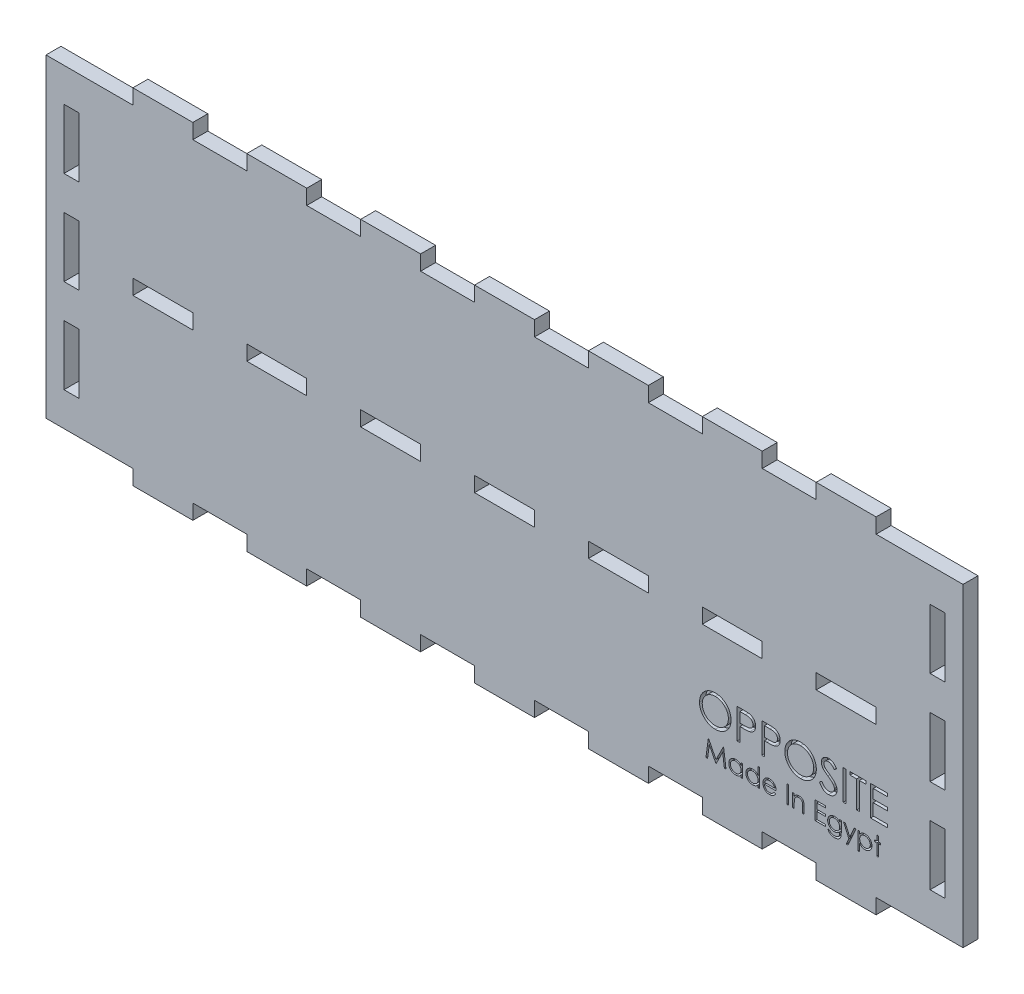
from build123d import *

# Parameters (mm, degrees)
SKETCH1_W           = 2.5
SKETCH1_H           = 10
SKETCH1_W_2         = 10
SKETCH1_H_2         = 2.5
BOSS_EXTRUDE1_DEPTH = 2.5
SKETCH2_W           = 0.448717949
SKETCH2_H           = 5
SKETCH2_W_2         = 0.26923077
SKETCH2_H_2         = 3
CUT_EXTRUDE1_DEPTH  = 1


with BuildPart() as part:
    # Sketch1 → Boss-Extrude1 (new body)
    with BuildSketch(Plane.XY):
        Polygon((-76.5, 26.25), (-62, 26.25), (-62, 28.75), (-52, 28.75), (-52, 26.25), (-43, 26.25), (-43, 28.75), (-33, 28.75), (-33, 26.25), (-24, 26.25), (-24, 28.75), (-14, 28.75), (-14, 26.25), (-5, 26.25), (-5, 28.75), (5, 28.75), (5, 26.25), (14, 26.25), (14, 28.75), (24, 28.75), (24, 26.25), (33, 26.25), (33, 28.75), (43, 28.75), (43, 26.25), (52, 26.25), (52, 28.75), (62, 28.75), (62, 26.25), (76.5, 26.25), (76.5, -26.25), (62, -26.25), (62, -28.75), (52, -28.75), (52, -26.25), (43, -26.25), (43, -28.75), (33, -28.75), (33, -26.25), (24, -26.25), (24, -28.75), (14, -28.75), (14, -26.25), (5, -26.25), (5, -28.75), (-5, -28.75), (-5, -26.25), (-14, -26.25), (-14, -28.75), (-24, -28.75), (-24, -26.25), (-33, -26.25), (-33, -28.75), (-43, -28.75), (-43, -26.25), (-52, -26.25), (-52, -28.75), (-62, -28.75), (-62, -26.25), (-76.5, -26.25), align=None)
        with Locations((-72.25, 15.625)):
            Rectangle(SKETCH1_W, SKETCH1_H, mode=Mode.SUBTRACT)
        with Locations((72.25, 15.625)):
            Rectangle(SKETCH1_W, SKETCH1_H, mode=Mode.SUBTRACT)
        with Locations((72.25, 0)):
            Rectangle(SKETCH1_W, SKETCH1_H, mode=Mode.SUBTRACT)
        with Locations((-72.25, 0)):
            Rectangle(SKETCH1_W, SKETCH1_H, mode=Mode.SUBTRACT)
        with Locations((72.25, -15.625)):
            Rectangle(SKETCH1_W, SKETCH1_H, mode=Mode.SUBTRACT)
        with Locations((-72.25, -15.625)):
            Rectangle(SKETCH1_W, SKETCH1_H, mode=Mode.SUBTRACT)
        with Locations((-38, 0)):
            Rectangle(SKETCH1_W_2, SKETCH1_H_2, mode=Mode.SUBTRACT)
        with Locations((-57, 0)):
            Rectangle(SKETCH1_W_2, SKETCH1_H_2, mode=Mode.SUBTRACT)
        with Locations((-19, 0)):
            Rectangle(SKETCH1_W_2, SKETCH1_H_2, mode=Mode.SUBTRACT)
        Rectangle(SKETCH1_W_2, SKETCH1_H_2, mode=Mode.SUBTRACT)
        with Locations((19, 0)):
            Rectangle(SKETCH1_W_2, SKETCH1_H_2, mode=Mode.SUBTRACT)
        with Locations((38, 0)):
            Rectangle(SKETCH1_W_2, SKETCH1_H_2, mode=Mode.SUBTRACT)
        with Locations((57, 0)):
            Rectangle(SKETCH1_W_2, SKETCH1_H_2, mode=Mode.SUBTRACT)
    extrude(amount=BOSS_EXTRUDE1_DEPTH)

    # Sketch2 → Cut-Extrude1 (cut)
    # profile 1 of 19: a face of its own
    with BuildSketch(Plane.XY.offset(2.5)):
        with BuildLine():
            add(Edge.make_bspline(
                [(35.135157571, -10.093090137), (35.227740579, -10.095435107), (35.409581247, -10.100040823), (35.6768311, -10.135296685), (35.931966951, -10.196290099), (36.177067149, -10.277522931), (36.409199973, -10.385886339), (36.630112676, -10.516865122), (36.839279639, -10.671831492), (37.033881613, -10.84958753), (37.21196297, -11.042992464), (37.368857093, -11.249389479), (37.500346084, -11.467530625), (37.60832578, -11.696760383), (37.69303808, -11.936560337), (37.751493857, -12.188208913), (37.788834071, -12.450075613), (37.793199467, -12.628685419), (37.795413981, -12.71929206)],
                knots=[0, 0, 0, 0, 1.065120563, 2.091984664, 3.0946048, 4.079830382, 5.057816894, 6.036188127, 7.030412546, 8.04752943, 9.064399622, 10.05169764, 11.02544977, 11.989514704, 12.962713494, 13.945757189, 14.957906945, 16, 16, 16, 16], degree=3))
            add(Edge.make_bspline(
                [(37.795413981, -12.71929206), (37.793199792, -12.809231269), (37.788835368, -12.986511869), (37.7514514, -13.24671679), (37.6928214, -13.496846356), (37.609112449, -13.736483003), (37.501647479, -13.965879522), (37.369282949, -14.184432314), (37.213366934, -14.392213026), (37.035928575, -14.586945405), (36.842498515, -14.76551322), (36.635026706, -14.921111614), (36.418179106, -15.05500322), (36.189165237, -15.16183704), (35.951022327, -15.247225498), (35.701619008, -15.305443541), (35.442123931, -15.34299646), (35.265165354, -15.347308625), (35.175221674, -15.349500393)],
                knots=[0, 0, 0, 0, 1.043624062, 2.057103931, 3.04512605, 4.022047818, 4.998200453, 5.980619268, 6.982898556, 8.009068085, 9.034988726, 10.034168286, 11.015286542, 11.987931943, 12.962482838, 13.94673481, 14.956375938, 16, 16, 16, 16], degree=3))
            add(Edge.make_bspline(
                [(35.175221674, -15.349500393), (35.084615504, -15.347286983), (34.906006624, -15.342923763), (34.643810859, -15.305521756), (34.391985511, -15.24703418), (34.151250723, -15.163449271), (33.921472252, -15.055424655), (33.702200705, -14.923704114), (33.494316209, -14.767408198), (33.299542286, -14.590027377), (33.121329146, -14.39692516), (32.965958609, -14.190019081), (32.834208447, -13.973368429), (32.726546543, -13.746371966), (32.641311602, -13.510127048), (32.583161861, -13.263057794), (32.545539073, -13.006572786), (32.541203578, -12.831940074), (32.539003725, -12.743330521)],
                knots=[0, 0, 0, 0, 1.053102029, 2.075944431, 3.073151272, 4.055350789, 5.033113405, 6.020478099, 7.024410459, 8.052272461, 9.079885166, 10.07527673, 11.055994387, 12.023226415, 12.992069828, 13.970394897, 14.97016774, 16, 16, 16, 16], degree=3))
            add(Edge.make_bspline(
                [(32.539003725, -12.743330521), (32.53976749, -12.68385528), (32.541285385, -12.565655103), (32.559559231, -12.390131389), (32.586075947, -12.217430449), (32.624078679, -12.04804338), (32.673781061, -11.882384831), (32.732426814, -11.719312312), (32.804055165, -11.560478421), (32.885027519, -11.405130719), (32.97540153, -11.255690853), (33.07522403, -11.114434306), (33.180988842, -10.980175739), (33.296936547, -10.856394305), (33.419245754, -10.739489082), (33.54990058, -10.631256629), (33.688103786, -10.530720985), (33.834450043, -10.440120497), (33.985333293, -10.358178877), (34.140871547, -10.287861947), (34.298952363, -10.22751043), (34.460316146, -10.178594966), (34.624534392, -10.139977771), (34.791965513, -10.113681552), (34.962476122, -10.095361098), (35.077349435, -10.09385038), (35.135157571, -10.093090137)],
                knots=[0, 0, 0, 0, 1.037015668, 2.060948919, 3.074880161, 4.083647147, 5.086022904, 6.090072063, 7.104153813, 8.122640571, 9.144368836, 10.147691507, 11.138137339, 12.123020368, 13.103399296, 14.087645067, 15.080126199, 16.082011238, 17.087798457, 18.072939717, 19.057185487, 20.037253025, 21.01195951, 21.997135196, 22.992090687, 24, 24, 24, 24], degree=3))
        make_face()
        with BuildLine():
            add(Edge.make_bspline(
                [(35.157192827, -10.605910649), (35.109743351, -10.606489064), (35.015298018, -10.607640364), (34.874891538, -10.622805672), (34.736331632, -10.644419799), (34.599589686, -10.675250543), (34.465237844, -10.717256332), (34.332023786, -10.765600487), (34.20116228, -10.824487759), (34.07308534, -10.891020194), (33.948920947, -10.964661509), (33.831759945, -11.046049748), (33.721299025, -11.133276254), (33.617808644, -11.226544593), (33.521592684, -11.326329739), (33.430757396, -11.431118933), (33.348943708, -11.543907349), (33.273964313, -11.661636501), (33.206867398, -11.784153046), (33.147202606, -11.910167135), (33.098396879, -12.040706688), (33.058593484, -12.174355484), (33.025593754, -12.310901855), (33.004688148, -12.451381639), (32.989356206, -12.595088942), (32.988270713, -12.692205876), (32.987721674, -12.741327316)],
                knots=[0, 0, 0, 0, 1.008559885, 2.007477868, 2.99961109, 3.989939068, 4.984837346, 5.991145699, 7.001802488, 8.033829008, 9.059044045, 10.069351652, 11.065060232, 12.050310815, 13.029377138, 14.011219647, 14.996725999, 15.989392538, 16.977580475, 17.965360261, 18.951710183, 19.937753436, 20.929683414, 21.935841486, 22.955955122, 24, 24, 24, 24], degree=3))
            add(Edge.make_bspline(
                [(32.987721674, -12.741327316), (32.989542905, -12.81355906), (32.99312583, -12.955661246), (33.024493788, -13.163901452), (33.072810894, -13.364027575), (33.144035703, -13.554944588), (33.23310801, -13.738293564), (33.343146425, -13.912447999), (33.473516547, -14.077454962), (33.621607299, -14.232162489), (33.78349688, -14.373370781), (33.95540078, -14.497318508), (34.135477362, -14.602190293), (34.324196223, -14.687626111), (34.52054985, -14.755325736), (34.725803495, -14.801723781), (34.938589865, -14.832260146), (35.083633659, -14.835192654), (35.157192827, -14.83667988)],
                knots=[0, 0, 0, 0, 1.032063989, 2.030389145, 3.003944642, 3.970395727, 4.937377036, 5.913328081, 6.909231446, 7.93887556, 8.970685674, 9.976071282, 10.964166581, 11.944589148, 12.933237628, 13.927779006, 14.949070134, 16, 16, 16, 16], degree=3))
            add(Edge.make_bspline(
                [(35.157192827, -14.83667988), (35.206634973, -14.836000588), (35.304693596, -14.834653348), (35.450544342, -14.82108381), (35.593767502, -14.799323996), (35.734162187, -14.767994488), (35.871569061, -14.728784194), (36.006561637, -14.682201725), (36.137702051, -14.62408572), (36.266644677, -14.55987436), (36.390067879, -14.486674135), (36.507890068, -14.408048207), (36.617141468, -14.320950178), (36.720554427, -14.229067588), (36.817165411, -14.130547806), (36.906321103, -14.025518917), (36.987721292, -13.913317978), (37.062672216, -13.795767399), (37.12953402, -13.672915609), (37.187789875, -13.546444641), (37.237212898, -13.416665913), (37.277110762, -13.283392239), (37.308375707, -13.146876741), (37.32991845, -13.00693663), (37.344987648, -12.863851855), (37.346123473, -12.767074917), (37.346696033, -12.718290457)],
                knots=[0, 0, 0, 0, 1.047197238, 2.076906641, 3.100256066, 4.114471768, 5.12198147, 6.126382909, 7.136867548, 8.15857795, 9.17633901, 10.174870724, 11.156907918, 12.133735059, 13.104061851, 14.077631395, 15.04955518, 16.038496417, 17.029181396, 18.010275684, 18.986308667, 19.968651475, 20.955262928, 21.950658345, 22.966943676, 24, 24, 24, 24], degree=3))
            add(Edge.make_bspline(
                [(37.346696033, -12.718290457), (37.346123014, -12.669839737), (37.344986326, -12.573728808), (37.329925648, -12.431641924), (37.308352948, -12.292708765), (37.277263365, -12.157474761), (37.237191717, -12.025905439), (37.187781245, -11.898124371), (37.129516531, -11.773655521), (37.062647639, -11.652806525), (36.987482177, -11.536842614), (36.905347544, -11.425982025), (36.814825618, -11.32230668), (36.718502725, -11.223257117), (36.613972889, -11.130945846), (36.501709612, -11.045342245), (36.383075786, -10.964380425), (36.25746545, -10.891343908), (36.12783123, -10.823895004), (35.99481129, -10.766107857), (35.859912577, -10.717004829), (35.72347813, -10.67512345), (35.58435959, -10.64454055), (35.443496977, -10.622786193), (35.301085179, -10.607645642), (35.205309151, -10.606490815), (35.157192827, -10.605910649)],
                knots=[0, 0, 0, 0, 1.02996197, 2.043119294, 3.035359645, 4.018872909, 4.991431989, 5.957985074, 6.929999688, 7.912076566, 8.892894881, 9.867085534, 10.843653904, 11.817741046, 12.803660682, 13.806313499, 14.818574707, 15.856120519, 16.894564902, 17.924820532, 18.937903209, 19.946497019, 20.957711757, 21.963978472, 22.977135795, 24, 24, 24, 24], degree=3))
        make_face(mode=Mode.SUBTRACT)
    # profile 2 of 19: a face of its own
    with BuildSketch(Plane.XY.offset(2.5)):
        with BuildLine():
            Line((38.821055007, -10.221295265), (39.801623917, -10.221295265))
            add(Edge.make_bspline(
                [(39.801623917, -10.221295265), (39.869068069, -10.221369402), (39.998294059, -10.221511453), (40.183601281, -10.225818233), (40.351900898, -10.23157065), (40.502830013, -10.239544783), (40.63685301, -10.248968483), (40.753363438, -10.262185683), (40.85327709, -10.275986105), (40.913143447, -10.290016686), (40.940446033, -10.296415457)],
                knots=[0, 0, 0, 0, 1.415646017, 2.712440637, 3.8905458, 4.950247383, 5.884950622, 6.709939814, 7.411656543, 8, 8, 8, 8], degree=3))
            add(Edge.make_bspline(
                [(40.940446033, -10.296415457), (40.975008224, -10.305875385), (41.043318191, -10.324572331), (41.141748253, -10.362020507), (41.235396603, -10.4064236), (41.324584544, -10.457029229), (41.408216091, -10.516008606), (41.487539007, -10.580970917), (41.561853264, -10.653416015), (41.630740967, -10.732531358), (41.694004964, -10.8169888), (41.748475939, -10.908049129), (41.794086263, -11.004179562), (41.833205223, -11.105313235), (41.861360158, -11.212299412), (41.882570014, -11.324394715), (41.896032339, -11.44158713), (41.897321713, -11.521672655), (41.897978084, -11.562441098)],
                knots=[0, 0, 0, 0, 0.999701418, 1.975846123, 2.934577507, 3.890451536, 4.834027766, 5.787354733, 6.749476667, 7.726910423, 8.712836071, 9.690891519, 10.682875813, 11.679750201, 12.712814741, 13.765529915, 14.8625177, 16, 16, 16, 16], degree=3))
            add(Edge.make_bspline(
                [(41.897978084, -11.562441098), (41.897376048, -11.603552208), (41.896198126, -11.683988871), (41.882060575, -11.801664282), (41.863017444, -11.914119125), (41.833735941, -12.021104055), (41.795384979, -12.121983727), (41.750396333, -12.218299772), (41.696134146, -12.308413589), (41.63378439, -12.392652329), (41.564424969, -12.471095061), (41.488349343, -12.543173338), (41.40586464, -12.60846525), (41.317232999, -12.66711717), (41.221590358, -12.717768998), (41.120387282, -12.763136576), (41.012744115, -12.801238092), (40.93825481, -12.821281036), (40.90038193, -12.831471547)],
                knots=[0, 0, 0, 0, 1.121902311, 2.195077645, 3.232258892, 4.234102512, 5.217864754, 6.176164875, 7.132989551, 8.084763148, 9.034132444, 9.988522005, 10.94243251, 11.903244335, 12.886203696, 13.894208494, 14.929344452, 16, 16, 16, 16], degree=3))
            add(Edge.make_bspline(
                [(40.90038193, -12.831471547), (40.869057167, -12.838132948), (40.800407128, -12.852731797), (40.687346096, -12.869029593), (40.555709831, -12.882940451), (40.405678002, -12.893370647), (40.237385281, -12.902299745), (40.050740628, -12.909397022), (39.84537766, -12.913296813), (39.702133026, -12.913497946), (39.627345071, -12.913602957)],
                knots=[0, 0, 0, 0, 0.601384939, 1.31797006, 2.144135048, 3.087295005, 4.142315834, 5.309527816, 6.595305764, 8, 8, 8, 8], degree=3))
            Line((39.627345071, -12.913602957), (39.269772956, -12.913602957))
            Line((39.269772956, -12.913602957), (39.269772956, -15.221295265))
            Line((39.269772956, -15.221295265), (38.821055007, -15.221295265))
            Line((38.821055007, -15.221295265), (38.821055007, -10.221295265))
        make_face()
        with BuildLine():
            Line((39.269772956, -10.734115778), (39.269772956, -12.400782444))
            Line((39.269772956, -12.400782444), (40.145173597, -12.411800072))
            add(Edge.make_bspline(
                [(40.145173597, -12.411800072), (40.187916348, -12.411822163), (40.270430348, -12.411864809), (40.389624952, -12.406171633), (40.500209648, -12.399599443), (40.601844756, -12.389976695), (40.694576091, -12.376374899), (40.778558275, -12.362643845), (40.853140108, -12.342779041), (40.940424682, -12.3160318), (41.037686607, -12.270413777), (41.14349739, -12.204199649), (41.233169657, -12.119798637), (41.310767223, -12.024901735), (41.372347049, -11.91933155), (41.417427038, -11.806375926), (41.443914406, -11.687193284), (41.447466111, -11.6056388), (41.449260135, -11.564444303)],
                knots=[0, 0, 0, 0, 1.160613943, 2.240541288, 3.23993089, 4.169200891, 5.011653406, 5.7853311, 6.478053781, 7.106038997, 8.262395093, 9.384106736, 10.481365981, 11.59014053, 12.70357646, 13.786202915, 14.881775077, 16, 16, 16, 16], degree=3))
            add(Edge.make_bspline(
                [(41.449260135, -11.564444303), (41.447456354, -11.524246427), (41.443870662, -11.444338024), (41.417219429, -11.327225509), (41.372434694, -11.215460217), (41.310353845, -11.111212952), (41.235009374, -11.016657518), (41.147438884, -10.934518765), (41.04784851, -10.868487761), (40.95520818, -10.825868787), (40.872920772, -10.799846965), (40.801446543, -10.78164005), (40.72074558, -10.76710347), (40.630791609, -10.755332751), (40.532281846, -10.745256378), (40.424369968, -10.738419268), (40.307464763, -10.734417187), (40.226306805, -10.73421868), (40.184236097, -10.734115778)],
                knots=[0, 0, 0, 0, 1.120700087, 2.227813068, 3.331159281, 4.466773991, 5.599788987, 6.693661531, 7.80175334, 8.91857717, 9.525282508, 10.207424825, 10.974604443, 11.810962634, 12.737642355, 13.736264703, 14.826523623, 16, 16, 16, 16], degree=3))
            Line((40.184236097, -10.734115778), (39.269772956, -10.734115778))
        make_face(mode=Mode.SUBTRACT)
    # profile 3 of 19: a face of its own
    with BuildSketch(Plane.XY.offset(2.5)):
        with BuildLine():
            Line((42.923619109, -10.221295265), (43.90418802, -10.221295265))
            add(Edge.make_bspline(
                [(43.90418802, -10.221295265), (43.971632171, -10.221369402), (44.100858161, -10.221511453), (44.286165384, -10.225818233), (44.454465, -10.23157065), (44.605394116, -10.239544783), (44.739417113, -10.248968483), (44.855927541, -10.262185683), (44.955841193, -10.275986105), (45.015707549, -10.290016686), (45.043010135, -10.296415457)],
                knots=[0, 0, 0, 0, 1.415646017, 2.712440637, 3.8905458, 4.950247383, 5.884950622, 6.709939814, 7.411656543, 8, 8, 8, 8], degree=3))
            add(Edge.make_bspline(
                [(45.043010135, -10.296415457), (45.077572326, -10.305875385), (45.145882294, -10.324572331), (45.244312355, -10.362020507), (45.337960706, -10.4064236), (45.427148647, -10.457029229), (45.510780194, -10.516008606), (45.590103109, -10.580970917), (45.664417367, -10.653416015), (45.73330507, -10.732531358), (45.796569066, -10.8169888), (45.851040042, -10.908049129), (45.896650366, -11.004179562), (45.935769325, -11.105313235), (45.96392426, -11.212299412), (45.985134117, -11.324394715), (45.998596442, -11.44158713), (45.999885816, -11.521672655), (46.000542186, -11.562441098)],
                knots=[0, 0, 0, 0, 0.999701418, 1.975846123, 2.934577507, 3.890451536, 4.834027766, 5.787354733, 6.749476667, 7.726910423, 8.712836071, 9.690891519, 10.682875813, 11.679750201, 12.712814741, 13.765529915, 14.8625177, 16, 16, 16, 16], degree=3))
            add(Edge.make_bspline(
                [(46.000542186, -11.562441098), (45.999940151, -11.603552208), (45.998762228, -11.683988871), (45.984624678, -11.801664282), (45.965581547, -11.914119125), (45.936300044, -12.021104055), (45.897949082, -12.121983727), (45.852960435, -12.218299772), (45.798698249, -12.308413589), (45.736348492, -12.392652329), (45.666989072, -12.471095061), (45.590913446, -12.543173338), (45.508428742, -12.60846525), (45.419797102, -12.66711717), (45.324154461, -12.717768998), (45.222951384, -12.763136576), (45.115308218, -12.801238092), (45.040818912, -12.821281036), (45.002946033, -12.831471547)],
                knots=[0, 0, 0, 0, 1.121902311, 2.195077645, 3.232258892, 4.234102512, 5.217864754, 6.176164875, 7.132989551, 8.084763148, 9.034132444, 9.988522005, 10.94243251, 11.903244335, 12.886203696, 13.894208494, 14.929344452, 16, 16, 16, 16], degree=3))
            add(Edge.make_bspline(
                [(45.002946033, -12.831471547), (44.97162127, -12.838132948), (44.902971231, -12.852731797), (44.789910199, -12.869029593), (44.658273933, -12.882940451), (44.508242105, -12.893370647), (44.339949384, -12.902299745), (44.15330473, -12.909397022), (43.947941763, -12.913296813), (43.804697128, -12.913497946), (43.729909174, -12.913602957)],
                knots=[0, 0, 0, 0, 0.601384939, 1.31797006, 2.144135048, 3.087295005, 4.142315834, 5.309527816, 6.595305764, 8, 8, 8, 8], degree=3))
            Line((43.729909174, -12.913602957), (43.372337058, -12.913602957))
            Line((43.372337058, -12.913602957), (43.372337058, -15.221295265))
            Line((43.372337058, -15.221295265), (42.923619109, -15.221295265))
            Line((42.923619109, -15.221295265), (42.923619109, -10.221295265))
        make_face()
        with BuildLine():
            Line((43.372337058, -10.734115778), (43.372337058, -12.400782444))
            Line((43.372337058, -12.400782444), (44.247737699, -12.411800072))
            add(Edge.make_bspline(
                [(44.247737699, -12.411800072), (44.29048045, -12.411822163), (44.37299445, -12.411864809), (44.492189055, -12.406171633), (44.602773751, -12.399599443), (44.704408859, -12.389976695), (44.797140194, -12.376374899), (44.881122378, -12.362643845), (44.955704211, -12.342779041), (45.042988784, -12.3160318), (45.140250709, -12.270413777), (45.246061493, -12.204199649), (45.335733759, -12.119798637), (45.413331326, -12.024901735), (45.474911152, -11.91933155), (45.519991141, -11.806375926), (45.546478508, -11.687193284), (45.550030214, -11.6056388), (45.551824238, -11.564444303)],
                knots=[0, 0, 0, 0, 1.160613943, 2.240541288, 3.23993089, 4.169200891, 5.011653406, 5.7853311, 6.478053781, 7.106038997, 8.262395093, 9.384106736, 10.481365981, 11.59014053, 12.70357646, 13.786202915, 14.881775077, 16, 16, 16, 16], degree=3))
            add(Edge.make_bspline(
                [(45.551824238, -11.564444303), (45.550020457, -11.524246427), (45.546434764, -11.444338024), (45.519783531, -11.327225509), (45.474998797, -11.215460217), (45.412917948, -11.111212952), (45.337573476, -11.016657518), (45.250002986, -10.934518765), (45.150412613, -10.868487761), (45.057772283, -10.825868787), (44.975484874, -10.799846965), (44.904010646, -10.78164005), (44.823309682, -10.76710347), (44.733355711, -10.755332751), (44.634845949, -10.745256378), (44.52693407, -10.738419268), (44.410028866, -10.734417187), (44.328870907, -10.73421868), (44.286800199, -10.734115778)],
                knots=[0, 0, 0, 0, 1.120700087, 2.227813068, 3.331159281, 4.466773991, 5.599788987, 6.693661531, 7.80175334, 8.91857717, 9.525282508, 10.207424825, 10.974604443, 11.810962634, 12.737642355, 13.736264703, 14.826523623, 16, 16, 16, 16], degree=3))
            Line((44.286800199, -10.734115778), (43.372337058, -10.734115778))
        make_face(mode=Mode.SUBTRACT)
    # profile 4 of 19: a face of its own
    with BuildSketch(Plane.XY.offset(2.5)):
        with BuildLine():
            add(Edge.make_bspline(
                [(49.365926802, -10.093090137), (49.45850981, -10.095435107), (49.640350477, -10.100040823), (49.907600331, -10.135296685), (50.162736182, -10.196290099), (50.40783638, -10.277522931), (50.639969204, -10.385886339), (50.860881907, -10.516865122), (51.07004887, -10.671831492), (51.264650843, -10.84958753), (51.442732201, -11.042992464), (51.599626324, -11.249389479), (51.731115315, -11.467530625), (51.839095011, -11.696760383), (51.923807311, -11.936560337), (51.982263087, -12.188208913), (52.019603302, -12.450075613), (52.023968698, -12.628685419), (52.026183212, -12.71929206)],
                knots=[0, 0, 0, 0, 1.065120563, 2.091984664, 3.0946048, 4.079830382, 5.057816894, 6.036188127, 7.030412546, 8.04752943, 9.064399622, 10.05169764, 11.02544977, 11.989514704, 12.962713494, 13.945757189, 14.957906945, 16, 16, 16, 16], degree=3))
            add(Edge.make_bspline(
                [(52.026183212, -12.71929206), (52.023969023, -12.809231269), (52.019604599, -12.986511869), (51.982220631, -13.24671679), (51.923590631, -13.496846356), (51.839881679, -13.736483003), (51.73241671, -13.965879522), (51.60005218, -14.184432314), (51.444136165, -14.392213026), (51.266697806, -14.586945405), (51.073267746, -14.76551322), (50.865795936, -14.921111614), (50.648948336, -15.05500322), (50.419934468, -15.16183704), (50.181791558, -15.247225498), (49.932388239, -15.305443541), (49.672893162, -15.34299646), (49.495934585, -15.347308625), (49.405990904, -15.349500393)],
                knots=[0, 0, 0, 0, 1.043624062, 2.057103931, 3.04512605, 4.022047818, 4.998200453, 5.980619268, 6.982898556, 8.009068085, 9.034988726, 10.034168286, 11.015286542, 11.987931943, 12.962482838, 13.94673481, 14.956375938, 16, 16, 16, 16], degree=3))
            add(Edge.make_bspline(
                [(49.405990904, -15.349500393), (49.315384734, -15.347286983), (49.136775854, -15.342923763), (48.87458009, -15.305521756), (48.622754741, -15.24703418), (48.382019954, -15.163449271), (48.152241483, -15.055424655), (47.932969936, -14.923704114), (47.72508544, -14.767408198), (47.530311517, -14.590027377), (47.352098376, -14.39692516), (47.19672784, -14.190019081), (47.064977678, -13.973368429), (46.957315774, -13.746371966), (46.872080832, -13.510127048), (46.813931092, -13.263057794), (46.776308303, -13.006572786), (46.771972808, -12.831940074), (46.769772956, -12.743330521)],
                knots=[0, 0, 0, 0, 1.053102029, 2.075944431, 3.073151272, 4.055350789, 5.033113405, 6.020478099, 7.024410459, 8.052272461, 9.079885166, 10.07527673, 11.055994387, 12.023226415, 12.992069828, 13.970394897, 14.97016774, 16, 16, 16, 16], degree=3))
            add(Edge.make_bspline(
                [(46.769772956, -12.743330521), (46.770536721, -12.68385528), (46.772054615, -12.565655103), (46.790328462, -12.390131389), (46.816845178, -12.217430449), (46.85484791, -12.04804338), (46.904550291, -11.882384831), (46.963196045, -11.719312312), (47.034824395, -11.560478421), (47.11579675, -11.405130719), (47.206170761, -11.255690853), (47.30599326, -11.114434306), (47.411758072, -10.980175739), (47.527705778, -10.856394305), (47.650014985, -10.739489082), (47.780669811, -10.631256629), (47.918873017, -10.530720985), (48.065219274, -10.440120497), (48.216102524, -10.358178877), (48.371640778, -10.287861947), (48.529721594, -10.22751043), (48.691085377, -10.178594966), (48.855303623, -10.139977771), (49.022734744, -10.113681552), (49.193245353, -10.095361098), (49.308118665, -10.09385038), (49.365926802, -10.093090137)],
                knots=[0, 0, 0, 0, 1.037015668, 2.060948919, 3.074880161, 4.083647147, 5.086022904, 6.090072063, 7.104153813, 8.122640571, 9.144368836, 10.147691507, 11.138137339, 12.123020368, 13.103399296, 14.087645067, 15.080126199, 16.082011238, 17.087798457, 18.072939717, 19.057185487, 20.037253025, 21.01195951, 21.997135196, 22.992090687, 24, 24, 24, 24], degree=3))
        make_face()
        with BuildLine():
            add(Edge.make_bspline(
                [(49.387962058, -10.605910649), (49.340512582, -10.606489064), (49.246067249, -10.607640364), (49.105660769, -10.622805672), (48.967100863, -10.644419799), (48.830358917, -10.675250543), (48.696007075, -10.717256332), (48.562793016, -10.765600487), (48.431931511, -10.824487759), (48.303854571, -10.891020194), (48.179690178, -10.964661509), (48.062529176, -11.046049748), (47.952068256, -11.133276254), (47.848577875, -11.226544593), (47.752361915, -11.326329739), (47.661526627, -11.431118933), (47.579712939, -11.543907349), (47.504733543, -11.661636501), (47.437636629, -11.784153046), (47.377971836, -11.910167135), (47.329166109, -12.040706688), (47.289362715, -12.174355484), (47.256362985, -12.310901855), (47.235457379, -12.451381639), (47.220125437, -12.595088942), (47.219039944, -12.692205876), (47.218490904, -12.741327316)],
                knots=[0, 0, 0, 0, 1.008559885, 2.007477868, 2.99961109, 3.989939068, 4.984837346, 5.991145699, 7.001802488, 8.033829008, 9.059044045, 10.069351652, 11.065060232, 12.050310815, 13.029377138, 14.011219647, 14.996725999, 15.989392538, 16.977580475, 17.965360261, 18.951710183, 19.937753436, 20.929683414, 21.935841486, 22.955955122, 24, 24, 24, 24], degree=3))
            add(Edge.make_bspline(
                [(47.218490904, -12.741327316), (47.220312136, -12.81355906), (47.223895061, -12.955661246), (47.255263019, -13.163901452), (47.303580125, -13.364027575), (47.374804934, -13.554944588), (47.463877241, -13.738293564), (47.573915655, -13.912447999), (47.704285778, -14.077454962), (47.85237653, -14.232162489), (48.014266111, -14.373370781), (48.186170011, -14.497318508), (48.366246593, -14.602190293), (48.554965454, -14.687626111), (48.751319081, -14.755325736), (48.956572725, -14.801723781), (49.169359096, -14.832260146), (49.314402889, -14.835192654), (49.387962058, -14.83667988)],
                knots=[0, 0, 0, 0, 1.032063989, 2.030389145, 3.003944642, 3.970395727, 4.937377036, 5.913328081, 6.909231446, 7.93887556, 8.970685674, 9.976071282, 10.964166581, 11.944589148, 12.933237628, 13.927779006, 14.949070134, 16, 16, 16, 16], degree=3))
            add(Edge.make_bspline(
                [(49.387962058, -14.83667988), (49.437404203, -14.836000588), (49.535462827, -14.834653348), (49.681313573, -14.82108381), (49.824536733, -14.799323996), (49.964931418, -14.767994488), (50.102338292, -14.728784194), (50.237330867, -14.682201725), (50.368471282, -14.62408572), (50.497413908, -14.55987436), (50.62083711, -14.486674135), (50.738659299, -14.408048207), (50.847910699, -14.320950178), (50.951323658, -14.229067588), (51.047934642, -14.130547806), (51.137090334, -14.025518917), (51.218490523, -13.913317978), (51.293441446, -13.795767399), (51.36030325, -13.672915609), (51.418559106, -13.546444641), (51.467982129, -13.416665913), (51.507879993, -13.283392239), (51.539144938, -13.146876741), (51.560687681, -13.00693663), (51.575756879, -12.863851855), (51.576892703, -12.767074917), (51.577465263, -12.718290457)],
                knots=[0, 0, 0, 0, 1.047197238, 2.076906641, 3.100256066, 4.114471768, 5.12198147, 6.126382909, 7.136867548, 8.15857795, 9.17633901, 10.174870724, 11.156907918, 12.133735059, 13.104061851, 14.077631395, 15.04955518, 16.038496417, 17.029181396, 18.010275684, 18.986308667, 19.968651475, 20.955262928, 21.950658345, 22.966943676, 24, 24, 24, 24], degree=3))
            add(Edge.make_bspline(
                [(51.577465263, -12.718290457), (51.576892245, -12.669839737), (51.575755557, -12.573728808), (51.560694879, -12.431641924), (51.539122178, -12.292708765), (51.508032595, -12.157474761), (51.467960947, -12.025905439), (51.418550475, -11.898124371), (51.360285762, -11.773655521), (51.29341687, -11.652806525), (51.218251408, -11.536842614), (51.136116774, -11.425982025), (51.045594848, -11.32230668), (50.949271956, -11.223257117), (50.84474212, -11.130945846), (50.732478842, -11.045342245), (50.613845017, -10.964380425), (50.488234681, -10.891343908), (50.358600461, -10.823895004), (50.225580521, -10.766107857), (50.090681807, -10.717004829), (49.954247361, -10.67512345), (49.815128821, -10.64454055), (49.674266208, -10.622786193), (49.53185441, -10.607645642), (49.436078382, -10.606490815), (49.387962058, -10.605910649)],
                knots=[0, 0, 0, 0, 1.02996197, 2.043119294, 3.035359645, 4.018872909, 4.991431989, 5.957985074, 6.929999688, 7.912076566, 8.892894881, 9.867085534, 10.843653904, 11.817741046, 12.803660682, 13.806313499, 14.818574707, 15.856120519, 16.894564902, 17.924820532, 18.937903209, 19.946497019, 20.957711757, 21.963978472, 22.977135795, 24, 24, 24, 24], degree=3))
        make_face(mode=Mode.SUBTRACT)
    # profile 5 of 19: a face of its own
    with BuildSketch(Plane.XY.offset(2.5)):
        with BuildLine():
            Line((52.539003725, -14.256751996), (52.961680007, -14.003346547))
            add(Edge.make_bspline(
                [(52.961680007, -14.003346547), (53.000991774, -14.069152811), (53.076311604, -14.195235074), (53.201956403, -14.365603703), (53.332146276, -14.510406784), (53.467845324, -14.628801938), (53.60822525, -14.722014633), (53.754202469, -14.788017821), (53.905285056, -14.8291835), (54.008104801, -14.834183624), (54.059436417, -14.83667988)],
                knots=[0, 0, 0, 0, 1.272034388, 2.437168799, 3.508375237, 4.49857839, 5.41946034, 6.295179144, 7.148887113, 8, 8, 8, 8], degree=3))
            add(Edge.make_bspline(
                [(54.059436417, -14.83667988), (54.103274789, -14.835458919), (54.190184465, -14.833038362), (54.318130526, -14.809780073), (54.442390244, -14.77404846), (54.560402584, -14.722875701), (54.670539176, -14.660963579), (54.767120169, -14.586183325), (54.850614617, -14.502460174), (54.918913352, -14.409056382), (54.971313402, -14.308603312), (55.011587785, -14.20549481), (55.033937891, -14.098111141), (55.037304681, -14.02581048), (55.039003725, -13.989324111)],
                knots=[0, 0, 0, 0, 1.095163259, 2.171163733, 3.241058638, 4.321873601, 5.38011039, 6.391990106, 7.366004449, 8.327778327, 9.272591725, 10.192022065, 11.087607919, 12, 12, 12, 12], degree=3))
            add(Edge.make_bspline(
                [(55.039003725, -13.989324111), (55.036897567, -13.947694326), (55.032616055, -13.863067055), (54.996428226, -13.738210408), (54.939500731, -13.614649594), (54.886982668, -13.538219215), (54.859716866, -13.498538854)],
                knots=[0, 0, 0, 0, 0.938893495, 1.908633276, 2.914225137, 4, 4, 4, 4], degree=3))
            add(Edge.make_bspline(
                [(54.859716866, -13.498538854), (54.837330274, -13.469900535), (54.790332425, -13.409777966), (54.709535979, -13.320284772), (54.614727244, -13.227972745), (54.509150737, -13.129316949), (54.38896061, -13.028905811), (54.257921304, -12.921951129), (54.112687219, -12.812520304), (54.010830796, -12.739130925), (53.958274558, -12.701263213)],
                knots=[0, 0, 0, 0, 0.722233717, 1.516239348, 2.393582979, 3.351407094, 4.387010283, 5.505090956, 6.712668013, 8, 8, 8, 8], degree=3))
            add(Edge.make_bspline(
                [(53.958274558, -12.701263213), (53.905668849, -12.663793803), (53.80509074, -12.592155142), (53.664435622, -12.485834736), (53.538657818, -12.388629209), (53.428316366, -12.299623477), (53.333459799, -12.21880547), (53.25334064, -12.146951271), (53.189999844, -12.082117613), (53.154777586, -12.040058553), (53.138963661, -12.021175072)],
                knots=[0, 0, 0, 0, 1.452282411, 2.77665338, 3.964542531, 5.026858415, 5.96415736, 6.766646006, 7.446254459, 8, 8, 8, 8], degree=3))
            add(Edge.make_bspline(
                [(53.138963661, -12.021175072), (53.116860025, -11.99174502), (53.073390258, -11.933866872), (53.01601025, -11.843402789), (52.967240018, -11.750798124), (52.929008115, -11.655804032), (52.896813516, -11.559754134), (52.875159329, -11.461395211), (52.861600191, -11.361168613), (52.860211639, -11.293720755), (52.859516545, -11.259957124)],
                knots=[0, 0, 0, 0, 1.068054152, 2.10047183, 3.106115577, 4.101338837, 5.06977816, 6.043150881, 7.020423561, 8, 8, 8, 8], degree=3))
            add(Edge.make_bspline(
                [(52.859516545, -11.259957124), (52.86138113, -11.207057446), (52.865070444, -11.102388783), (52.896271183, -10.949487597), (52.945518174, -10.803507001), (53.014510871, -10.665892238), (53.103449946, -10.540226551), (53.206372767, -10.425064427), (53.328960604, -10.328252167), (53.463464352, -10.243663512), (53.610687741, -10.177455047), (53.76496046, -10.12751079), (53.926527706, -10.099211851), (54.035960755, -10.095150758), (54.091487699, -10.093090137)],
                knots=[0, 0, 0, 0, 1.005424448, 1.989358655, 2.955360095, 3.929531133, 4.905563448, 5.876582895, 6.856512386, 7.866279853, 8.892233794, 9.918561126, 10.94386622, 12, 12, 12, 12], degree=3))
            add(Edge.make_bspline(
                [(54.091487699, -10.093090137), (54.150407842, -10.095122353), (54.267581202, -10.099163783), (54.439937224, -10.134303114), (54.605881105, -10.192446931), (54.739371483, -10.258430728), (54.843846857, -10.32433275), (54.923522189, -10.38436107), (55.004261405, -10.453468369), (55.086715769, -10.53183872), (55.169488139, -10.620191222), (55.253807357, -10.717920777), (55.339870598, -10.824430143), (55.395236112, -10.900465144), (55.423619109, -10.939444303)],
                knots=[0, 0, 0, 0, 1.286793592, 2.559021753, 3.825965368, 5.121522368, 5.803751409, 6.523245864, 7.299691795, 8.125521123, 9.008227632, 9.944561021, 10.946284179, 12, 12, 12, 12], degree=3))
            Line((55.423619109, -10.939444303), (55.017970071, -11.24693629))
            add(Edge.make_bspline(
                [(55.017970071, -11.24693629), (54.993475882, -11.215381018), (54.9463058, -11.154612942), (54.874692248, -11.069511063), (54.807194179, -10.991773235), (54.740693608, -10.924251623), (54.678702706, -10.863248576), (54.618535503, -10.811020352), (54.561057858, -10.767055216), (54.488605129, -10.720135844), (54.397579817, -10.673626553), (54.283316193, -10.634270728), (54.163907229, -10.610620639), (54.082579184, -10.607493657), (54.041407571, -10.605910649)],
                knots=[0, 0, 0, 0, 1.181633172, 2.275549214, 3.290209073, 4.226197932, 5.078386478, 5.862611352, 6.581680152, 7.217281963, 8.414376989, 9.595101626, 10.782541182, 12, 12, 12, 12], degree=3))
            add(Edge.make_bspline(
                [(54.041407571, -10.605910649), (53.989755396, -10.607641649), (53.890149043, -10.61097972), (53.74873442, -10.647436841), (53.621457384, -10.704839499), (53.512096577, -10.785289468), (53.421043752, -10.880605172), (53.355178811, -10.99028925), (53.315535719, -11.111406968), (53.310698177, -11.195895049), (53.308234494, -11.23892347)],
                knots=[0, 0, 0, 0, 1.14458467, 2.207223713, 3.21896685, 4.227309161, 5.202851033, 6.127160689, 7.046193047, 8, 8, 8, 8], degree=3))
            add(Edge.make_bspline(
                [(53.308234494, -11.23892347), (53.308796104, -11.265711296), (53.309920241, -11.319330753), (53.325598523, -11.39854707), (53.345740422, -11.477563269), (53.377658467, -11.556024102), (53.421723187, -11.635301757), (53.479587724, -11.716761382), (53.552463884, -11.801120966), (53.608288187, -11.855988643), (53.637761738, -11.884957124)],
                knots=[0, 0, 0, 0, 0.858281714, 1.717966888, 2.583508476, 3.4729293, 4.427298488, 5.488583878, 6.674047936, 8, 8, 8, 8], degree=3))
            add(Edge.make_bspline(
                [(53.637761738, -11.884957124), (53.648706555, -11.894724303), (53.674708937, -11.917928887), (53.722245974, -11.955917859), (53.7850214, -12.002778962), (53.861395973, -12.060760843), (53.952777918, -12.128020075), (54.059177284, -12.203696663), (54.179408045, -12.290247319), (54.264725068, -12.350758092), (54.309837058, -12.382753598)],
                knots=[0, 0, 0, 0, 0.420754252, 0.999615792, 1.744751191, 2.668019286, 3.750313428, 4.999500688, 6.413464383, 8, 8, 8, 8], degree=3))
            add(Edge.make_bspline(
                [(54.309837058, -12.382753598), (54.364102649, -12.422241255), (54.469180443, -12.498703628), (54.618691272, -12.613583171), (54.754253855, -12.725937127), (54.876344146, -12.835047994), (54.986168301, -12.940088127), (55.082507902, -13.042321241), (55.166344588, -13.141014917), (55.256600614, -13.267547168), (55.348826071, -13.422948717), (55.428028224, -13.6133462), (55.47796872, -13.804483801), (55.484499457, -13.93295071), (55.487721674, -13.996335329)],
                knots=[0, 0, 0, 0, 1.163667725, 2.253281268, 3.268753668, 4.215851969, 5.092017293, 5.902905408, 6.650798638, 7.335211899, 8.59617414, 9.77448103, 10.901945474, 12, 12, 12, 12], degree=3))
            add(Edge.make_bspline(
                [(55.487721674, -13.996335329), (55.486782905, -14.041161565), (55.484923598, -14.129943541), (55.463550864, -14.260307937), (55.432237056, -14.386923465), (55.385041008, -14.508225054), (55.327436496, -14.626431858), (55.254341856, -14.738443144), (55.169616592, -14.846737999), (55.072425499, -14.948428701), (54.96607421, -15.04178041), (54.853668932, -15.124821926), (54.735025685, -15.194062388), (54.61078809, -15.250563591), (54.480927609, -15.29475433), (54.345487918, -15.326772715), (54.204245759, -15.34642373), (54.108245071, -15.34846339), (54.059436417, -15.349500393)],
                knots=[0, 0, 0, 0, 0.983748083, 1.948392443, 2.894712957, 3.844097841, 4.80183111, 5.778335162, 6.776009319, 7.81870978, 8.863265674, 9.881300176, 10.883814829, 11.87499822, 12.874611388, 13.892143829, 14.928324115, 16, 16, 16, 16], degree=3))
            add(Edge.make_bspline(
                [(54.059436417, -15.349500393), (54.021671641, -15.348770134), (53.946617699, -15.347318812), (53.835604153, -15.334488411), (53.726833311, -15.316335406), (53.621670051, -15.287515306), (53.518759463, -15.252548196), (53.418549128, -15.209493435), (53.32099048, -15.157897433), (53.22553679, -15.098904541), (53.132430826, -15.03025062), (53.042545872, -14.950288482), (52.95293275, -14.861223475), (52.866236469, -14.760636956), (52.780703406, -14.65015398), (52.698019964, -14.528740861), (52.616474653, -14.397058927), (52.565309699, -14.304394519), (52.539003725, -14.256751996)],
                knots=[0, 0, 0, 0, 0.915332311, 1.819136955, 2.706846663, 3.586547465, 4.459518054, 5.340707479, 6.227863349, 7.133153174, 8.059268498, 9.028702269, 10.047606654, 11.120612155, 12.245963614, 13.433783089, 14.680604001, 16, 16, 16, 16], degree=3))
        make_face()
    # profile 6 of 19: a face of its own
    with BuildSketch(Plane.XY.offset(2.5)):
        with Locations((56.737721674, -12.721295265)):
            Rectangle(SKETCH2_W, SKETCH2_H)
    # profile 7 of 19: a face of its own
    with BuildSketch(Plane.XY.offset(2.5)):
        Polygon((57.667208853, -10.734115778), (57.667208853, -10.221295265), (60.295413981, -10.221295265), (60.295413981, -10.734115778), (59.205670392, -10.734115778), (59.205670392, -15.221295265), (58.756952443, -15.221295265), (58.756952443, -10.734115778), align=None)
    # profile 8 of 19: a face of its own
    with BuildSketch(Plane.XY.offset(2.5)):
        Polygon((61.06464475, -10.221295265), (63.885157571, -10.221295265), (63.885157571, -10.734115778), (61.513362699, -10.734115778), (61.513362699, -12.272577316), (63.885157571, -12.272577316), (63.885157571, -12.785397829), (61.513362699, -12.785397829), (61.513362699, -14.708474752), (63.885157571, -14.708474752), (63.885157571, -15.221295265), (61.06464475, -15.221295265), align=None)
    # profile 9 of 19: a face of its own
    with BuildSketch(Plane.XY.offset(2.5)):
        Polygon((33.609516545, -20.221295265), (34.005550199, -17.221295265), (34.044011738, -17.221295265), (35.282593468, -19.682833726), (36.518170392, -17.221295265), (36.557232892, -17.221295265), (36.955670392, -20.221295265), (36.685237699, -20.221295265), (36.397978084, -18.062641419), (35.315045392, -20.221295265), (35.254348276, -20.221295265), (34.167208853, -18.057833726), (33.880550199, -20.221295265), align=None)
    # profile 10 of 19: a face of its own
    with BuildSketch(Plane.XY.offset(2.5)):
        with BuildLine():
            Line((39.724901161, -18.028987572), (39.724901161, -20.221295265))
            Line((39.724901161, -20.221295265), (39.455670392, -20.221295265))
            Line((39.455670392, -20.221295265), (39.455670392, -19.842088534))
            add(Edge.make_bspline(
                [(39.455670392, -19.842088534), (39.425311428, -19.876408186), (39.366065529, -19.943383418), (39.267116, -20.030882423), (39.16222899, -20.103206699), (39.051913572, -20.161620912), (38.936269363, -20.205499818), (38.815552717, -20.236687954), (38.689714391, -20.256739813), (38.603783801, -20.258742117), (38.560237699, -20.259756803)],
                knots=[0, 0, 0, 0, 1.074387032, 2.096679803, 3.090159297, 4.057316773, 5.018401886, 5.985159533, 6.978961417, 8, 8, 8, 8], degree=3))
            add(Edge.make_bspline(
                [(38.560237699, -20.259756803), (38.52152231, -20.258705627), (38.445173849, -20.256632661), (38.332863211, -20.240550686), (38.22478414, -20.214724439), (38.120834507, -20.178809391), (38.021686953, -20.131168687), (37.926492585, -20.074133331), (37.835744563, -20.00621262), (37.750826101, -19.928565738), (37.672627244, -19.844227178), (37.604003296, -19.754273852), (37.54678637, -19.659094734), (37.498940587, -19.559894888), (37.462086577, -19.455910672), (37.436394891, -19.34750167), (37.420331651, -19.234796065), (37.418259541, -19.158047902), (37.417208853, -19.119131803)],
                knots=[0, 0, 0, 0, 1.033919861, 2.038935746, 3.024066025, 3.998881131, 4.97069526, 5.957263378, 6.95902576, 7.993208707, 9.027059324, 10.027763471, 11.009749337, 11.988697705, 12.965288445, 13.950418724, 14.960734635, 16, 16, 16, 16], degree=3))
            add(Edge.make_bspline(
                [(37.417208853, -19.119131803), (37.418282829, -19.081020057), (37.42040602, -19.005675192), (37.436223066, -18.894864879), (37.462821073, -18.788134941), (37.5001478, -18.68582899), (37.548012332, -18.587823233), (37.606236407, -18.494048354), (37.674824228, -18.404246013), (37.75389772, -18.320527819), (37.839556094, -18.243195864), (37.931192149, -18.175988111), (38.026526391, -18.117945097), (38.127037542, -18.071956403), (38.231237918, -18.034748599), (38.340055157, -18.009006055), (38.45303651, -17.993836923), (38.529742646, -17.991640268), (38.568651161, -17.990526034)],
                knots=[0, 0, 0, 0, 1.020392517, 2.01726096, 2.990465484, 3.961182959, 4.928053699, 5.906110375, 6.912531644, 7.948652711, 8.985773172, 9.998621852, 10.987621588, 11.969261332, 12.953316658, 13.946091881, 14.958173133, 16, 16, 16, 16], degree=3))
            add(Edge.make_bspline(
                [(38.568651161, -17.990526034), (38.613393897, -17.991758392), (38.701132291, -17.994174989), (38.829470585, -18.014285898), (38.950880137, -18.048261727), (39.066298154, -18.094476726), (39.17531017, -18.155889922), (39.276884157, -18.23335846), (39.372083142, -18.326393763), (39.42726625, -18.397854144), (39.455670392, -18.434636611)],
                knots=[0, 0, 0, 0, 1.038897134, 2.037228247, 3.008116434, 3.962042015, 4.918381754, 5.904844433, 6.921570401, 8, 8, 8, 8], degree=3))
            Line((39.455670392, -18.434636611), (39.455670392, -18.028987572))
            Line((39.455670392, -18.028987572), (39.724901161, -18.028987572))
        make_face()
        with BuildLine():
            add(Edge.make_bspline(
                [(38.57225693, -18.259756803), (38.532901783, -18.261157064), (38.455220983, -18.263920956), (38.341183267, -18.285498238), (38.232057484, -18.321399319), (38.12838942, -18.370498091), (38.031816663, -18.432237008), (37.945507802, -18.50691248), (37.868756915, -18.592487063), (37.804206975, -18.688574587), (37.751586549, -18.791584379), (37.714586236, -18.899262469), (37.690184023, -19.009666735), (37.687691006, -19.084549037), (37.686439622, -19.122136611)],
                knots=[0, 0, 0, 0, 1.031046209, 2.035121221, 3.029706178, 4.034933723, 5.034054252, 6.02443088, 7.017295772, 8.038157696, 9.050218397, 10.03989886, 11.016116709, 12, 12, 12, 12], degree=3))
            add(Edge.make_bspline(
                [(37.686439622, -19.122136611), (37.688038102, -19.15949956), (37.691228797, -19.234079008), (37.714157963, -19.344633788), (37.752626426, -19.452337253), (37.805119623, -19.556275247), (37.870851016, -19.652775904), (37.947041289, -19.739981724), (38.034427245, -19.814972799), (38.131222251, -19.877747862), (38.234600511, -19.928458595), (38.343315309, -19.963743429), (38.455322999, -19.986524383), (38.531482143, -19.989185364), (38.569853084, -19.990526034)],
                knots=[0, 0, 0, 0, 0.979072187, 1.954306742, 2.945804271, 3.96968567, 4.997920485, 5.998718438, 6.996577872, 8.005894225, 9.015743152, 10.005417472, 10.995077863, 12, 12, 12, 12], degree=3))
            add(Edge.make_bspline(
                [(38.569853084, -19.990526034), (38.608807229, -19.989103208), (38.68628316, -19.986273348), (38.800659196, -19.964603692), (38.911654878, -19.928801864), (39.017758217, -19.879174041), (39.116600615, -19.817667736), (39.205313081, -19.745661658), (39.280326769, -19.661916072), (39.343920434, -19.569879112), (39.393785077, -19.468983115), (39.430107413, -19.361553809), (39.45158219, -19.247587453), (39.454288815, -19.169704087), (39.455670392, -19.129949111)],
                knots=[0, 0, 0, 0, 1.01762866, 2.023962475, 3.030623092, 4.058876274, 5.077231937, 6.066672613, 7.034107872, 8.005628644, 8.981990164, 9.965428785, 10.961468474, 12, 12, 12, 12], degree=3))
            add(Edge.make_bspline(
                [(39.455670392, -19.129949111), (39.454847829, -19.099659542), (39.453228765, -19.040040085), (39.440859706, -18.952502213), (39.421184055, -18.868730447), (39.393458766, -18.788636714), (39.357037665, -18.712663844), (39.313111009, -18.640266335), (39.260906337, -18.571820725), (39.201264026, -18.508269521), (39.135979567, -18.450303982), (39.066898532, -18.398563204), (38.993202463, -18.356058542), (38.916130718, -18.320880309), (38.835549574, -18.292886752), (38.750803328, -18.274211586), (38.662792768, -18.261388454), (38.602753292, -18.260306413), (38.57225693, -18.259756803)],
                knots=[0, 0, 0, 0, 1.050140795, 2.067009409, 3.05949893, 4.030605086, 5.00011959, 5.97591094, 6.962425594, 7.979863591, 8.993523472, 9.986985069, 10.967611495, 11.937549037, 12.921786183, 13.919465291, 14.943216303, 16, 16, 16, 16], degree=3))
        make_face(mode=Mode.SUBTRACT)
    # profile 11 of 19: a face of its own
    with BuildSketch(Plane.XY.offset(2.5)):
        with BuildLine():
            Line((42.571055007, -17.144372188), (42.571055007, -20.221295265))
            Line((42.571055007, -20.221295265), (42.301824238, -20.221295265))
            Line((42.301824238, -20.221295265), (42.301824238, -19.842088534))
            add(Edge.make_bspline(
                [(42.301824238, -19.842088534), (42.271465274, -19.876408186), (42.212219375, -19.943383418), (42.113269846, -20.030882423), (42.008382836, -20.103206699), (41.898067418, -20.161620912), (41.782423209, -20.205499818), (41.661706563, -20.236687954), (41.535868237, -20.256739813), (41.449937647, -20.258742117), (41.406391545, -20.259756803)],
                knots=[0, 0, 0, 0, 1.074387032, 2.096679803, 3.090159297, 4.057316773, 5.018401886, 5.985159533, 6.978961417, 8, 8, 8, 8], degree=3))
            add(Edge.make_bspline(
                [(41.406391545, -20.259756803), (41.367676156, -20.258705627), (41.291327695, -20.256632661), (41.179017057, -20.240550686), (41.070937987, -20.214724439), (40.966988353, -20.178809391), (40.8678408, -20.131168687), (40.772646431, -20.074133331), (40.681898409, -20.00621262), (40.596979947, -19.928565738), (40.51878109, -19.844227178), (40.450157142, -19.754273852), (40.392940216, -19.659094734), (40.345094433, -19.559894888), (40.308240423, -19.455910672), (40.282548737, -19.34750167), (40.266485497, -19.234796065), (40.264413388, -19.158047902), (40.263362699, -19.119131803)],
                knots=[0, 0, 0, 0, 1.033919861, 2.038935746, 3.024066025, 3.998881131, 4.97069526, 5.957263378, 6.95902576, 7.993208707, 9.027059324, 10.027763471, 11.009749337, 11.988697705, 12.965288445, 13.950418724, 14.960734635, 16, 16, 16, 16], degree=3))
            add(Edge.make_bspline(
                [(40.263362699, -19.119131803), (40.264436675, -19.081020057), (40.266559866, -19.005675192), (40.282376912, -18.894864879), (40.308974919, -18.788134941), (40.346301646, -18.68582899), (40.394166179, -18.587823233), (40.452390253, -18.494048354), (40.520978074, -18.404246013), (40.600051566, -18.320527819), (40.685709941, -18.243195864), (40.777345996, -18.175988111), (40.872680237, -18.117945097), (40.973191389, -18.071956403), (41.077391764, -18.034748599), (41.186209003, -18.009006055), (41.299190357, -17.993836923), (41.375896493, -17.991640268), (41.414805007, -17.990526034)],
                knots=[0, 0, 0, 0, 1.020392517, 2.01726096, 2.990465484, 3.961182959, 4.928053699, 5.906110375, 6.912531644, 7.948652711, 8.985773172, 9.998621852, 10.987621588, 11.969261332, 12.953316658, 13.946091881, 14.958173133, 16, 16, 16, 16], degree=3))
            add(Edge.make_bspline(
                [(41.414805007, -17.990526034), (41.459562271, -17.991869259), (41.547415806, -17.994505861), (41.675900253, -18.01653989), (41.79743249, -18.053536642), (41.912712194, -18.104186312), (42.021052102, -18.170015527), (42.123246366, -18.249516768), (42.217517785, -18.344940036), (42.273293633, -18.416607099), (42.301824238, -18.453266419)],
                knots=[0, 0, 0, 0, 1.031072012, 2.023879775, 2.993683497, 3.952812103, 4.918022106, 5.908088563, 6.929940113, 8, 8, 8, 8], degree=3))
            Line((42.301824238, -18.453266419), (42.301824238, -17.144372188))
            Line((42.301824238, -17.144372188), (42.571055007, -17.144372188))
        make_face()
        with BuildLine():
            add(Edge.make_bspline(
                [(41.418410776, -18.259756803), (41.379055629, -18.261157064), (41.301374829, -18.263920956), (41.187337113, -18.285498238), (41.07821133, -18.321399319), (40.974543266, -18.370498091), (40.877970509, -18.432237008), (40.791661648, -18.50691248), (40.714910761, -18.592487063), (40.650360821, -18.688574587), (40.597740395, -18.791584379), (40.560740082, -18.899262469), (40.53633787, -19.009666735), (40.533844852, -19.084549037), (40.532593468, -19.122136611)],
                knots=[0, 0, 0, 0, 1.031046209, 2.035121221, 3.029706178, 4.034933723, 5.034054252, 6.02443088, 7.017295772, 8.038157696, 9.050218397, 10.03989886, 11.016116709, 12, 12, 12, 12], degree=3))
            add(Edge.make_bspline(
                [(40.532593468, -19.122136611), (40.534191948, -19.15949956), (40.537382643, -19.234079008), (40.56031181, -19.344633788), (40.598780272, -19.452337253), (40.651273469, -19.556275247), (40.717004862, -19.652775904), (40.793195135, -19.739981724), (40.880581091, -19.814972799), (40.977376097, -19.877747862), (41.080754357, -19.928458595), (41.189469156, -19.963743429), (41.301476845, -19.986524383), (41.377635989, -19.989185364), (41.41600693, -19.990526034)],
                knots=[0, 0, 0, 0, 0.979072187, 1.954306742, 2.945804271, 3.96968567, 4.997920485, 5.998718438, 6.996577872, 8.005894225, 9.015743152, 10.005417472, 10.995077863, 12, 12, 12, 12], degree=3))
            add(Edge.make_bspline(
                [(41.41600693, -19.990526034), (41.454961075, -19.989103208), (41.532437007, -19.986273348), (41.646813042, -19.964603692), (41.757808724, -19.928801864), (41.863912063, -19.879174041), (41.962754461, -19.817667736), (42.051466927, -19.745661658), (42.126480615, -19.661916072), (42.19007428, -19.569879112), (42.239938923, -19.468983115), (42.276261259, -19.361553809), (42.297736036, -19.247587453), (42.300442661, -19.169704087), (42.301824238, -19.129949111)],
                knots=[0, 0, 0, 0, 1.01762866, 2.023962475, 3.030623092, 4.058876274, 5.077231937, 6.066672613, 7.034107872, 8.005628644, 8.981990164, 9.965428785, 10.961468474, 12, 12, 12, 12], degree=3))
            add(Edge.make_bspline(
                [(42.301824238, -19.129949111), (42.301001675, -19.099659542), (42.299382612, -19.040040085), (42.287013552, -18.952502213), (42.267337901, -18.868730447), (42.239612612, -18.788636714), (42.203191511, -18.712663844), (42.159264855, -18.640266335), (42.107060184, -18.571820725), (42.047417873, -18.508269521), (41.982133413, -18.450303982), (41.913052378, -18.398563204), (41.83935631, -18.356058542), (41.762284564, -18.320880309), (41.68170342, -18.292886752), (41.596957174, -18.274211586), (41.508946614, -18.261388454), (41.448907138, -18.260306413), (41.418410776, -18.259756803)],
                knots=[0, 0, 0, 0, 1.050140795, 2.067009409, 3.05949893, 4.030605086, 5.00011959, 5.97591094, 6.962425594, 7.979863591, 8.993523472, 9.986985069, 10.967611495, 11.937549037, 12.921786183, 13.919465291, 14.943216303, 16, 16, 16, 16], degree=3))
        make_face(mode=Mode.SUBTRACT)
    # profile 12 of 19: a face of its own
    with BuildSketch(Plane.XY.offset(2.5)):
        with BuildLine():
            Line((44.985718468, -19.528987572), (45.224901161, -19.654588534))
            add(Edge.make_bspline(
                [(45.224901161, -19.654588534), (45.205841222, -19.688397104), (45.168758129, -19.754175192), (45.104986059, -19.844545358), (45.038135711, -19.9258434), (44.965189453, -19.995897389), (44.888329728, -20.056970005), (44.80713031, -20.110402426), (44.721168466, -20.155932587), (44.630440131, -20.194291896), (44.534183373, -20.223785748), (44.43216493, -20.244617938), (44.324189362, -20.257495025), (44.250178351, -20.25899086), (44.212280968, -20.259756803)],
                knots=[0, 0, 0, 0, 1.120438281, 2.179929193, 3.190490725, 4.156257408, 5.095198341, 6.022838206, 6.959905092, 7.901321166, 8.864066838, 9.862729781, 10.905609505, 12, 12, 12, 12], degree=3))
            add(Edge.make_bspline(
                [(44.212280968, -20.259756803), (44.170159273, -20.25877351), (44.087992049, -20.25685539), (43.968386552, -20.240318992), (43.855775622, -20.213342684), (43.75016559, -20.175657935), (43.651815088, -20.126434514), (43.560528641, -20.066469244), (43.47582619, -19.996070168), (43.400376868, -19.914627503), (43.33245354, -19.827471539), (43.272517123, -19.73665221), (43.222410753, -19.642398017), (43.181651373, -19.545308997), (43.148732918, -19.445997088), (43.125790029, -19.343558687), (43.11256453, -19.238271043), (43.110537863, -19.167044756), (43.109516545, -19.131151034)],
                knots=[0, 0, 0, 0, 1.145258523, 2.234067595, 3.276747158, 4.290159414, 5.277019952, 6.260822364, 7.254936242, 8.264827045, 9.274100331, 10.257902744, 11.220704747, 12.172965371, 13.118907548, 14.062713208, 15.023725156, 16, 16, 16, 16], degree=3))
            add(Edge.make_bspline(
                [(43.109516545, -19.131151034), (43.110424381, -19.097469751), (43.112223591, -19.030717895), (43.123564266, -18.931918857), (43.143662803, -18.835894469), (43.171242509, -18.742564942), (43.206857863, -18.652086542), (43.250428336, -18.564404202), (43.302021803, -18.479611225), (43.341855523, -18.426122824), (43.361920392, -18.39917988)],
                knots=[0, 0, 0, 0, 1.024358464, 2.0301432, 3.019427413, 4.004406732, 4.986367066, 5.972626655, 6.978780325, 8, 8, 8, 8], degree=3))
            add(Edge.make_bspline(
                [(43.361920392, -18.39917988), (43.389098405, -18.366720849), (43.442593502, -18.302831005), (43.533070378, -18.218883869), (43.631041975, -18.148560633), (43.735280512, -18.090268802), (43.84699749, -18.045977105), (43.964691168, -18.012970606), (44.08970167, -17.994475168), (44.175163288, -17.991862739), (44.218891545, -17.990526034)],
                knots=[0, 0, 0, 0, 1.030682036, 2.02871468, 2.997146059, 3.962720338, 4.930598197, 5.918074684, 6.934738563, 8, 8, 8, 8], degree=3))
            add(Edge.make_bspline(
                [(44.218891545, -17.990526034), (44.263846636, -17.991686647), (44.352038275, -17.993963506), (44.480637236, -18.015071792), (44.60231785, -18.04854541), (44.717031425, -18.095820088), (44.824789592, -18.156813989), (44.92489192, -18.232364139), (45.019050359, -18.320151071), (45.073829141, -18.387662393), (45.101704045, -18.422016419)],
                knots=[0, 0, 0, 0, 1.056321875, 2.072262726, 3.055038591, 4.01806755, 4.982017516, 5.957941055, 6.960871419, 8, 8, 8, 8], degree=3))
            add(Edge.make_bspline(
                [(45.101704045, -18.422016419), (45.120669992, -18.447905203), (45.158475644, -18.499510447), (45.205830301, -18.583657153), (45.246936639, -18.671694806), (45.279793463, -18.765046489), (45.30639875, -18.862606129), (45.325647452, -18.965071167), (45.336935696, -19.072411091), (45.33915458, -19.145548139), (45.340285776, -19.182833726)],
                knots=[0, 0, 0, 0, 0.94817472, 1.890038105, 2.849395472, 3.817997239, 4.812318967, 5.836947057, 6.897266129, 8, 8, 8, 8], degree=3))
            Line((45.340285776, -19.182833726), (43.378747315, -19.182833726))
            add(Edge.make_bspline(
                [(43.378747315, -19.182833726), (43.380066977, -19.211719838), (43.382662041, -19.268523213), (43.394760735, -19.351641027), (43.413831112, -19.430818178), (43.440633166, -19.505460785), (43.473090462, -19.576543751), (43.512849648, -19.643539783), (43.560283551, -19.706143723), (43.613191293, -19.764915555), (43.672083089, -19.817253351), (43.73403973, -19.86409773), (43.7999485, -19.90335967), (43.869289714, -19.935228147), (43.941951244, -19.960176418), (44.017955983, -19.977205979), (44.097154369, -19.98861207), (44.151142141, -19.989880355), (44.178627122, -19.990526034)],
                knots=[0, 0, 0, 0, 1.094153842, 2.151609401, 3.174256925, 4.172055639, 5.149267565, 6.128595816, 7.11444997, 8.118368179, 9.117203808, 10.09244225, 11.054858984, 12.015122123, 12.976791628, 13.957293641, 14.960065497, 16, 16, 16, 16], degree=3))
            add(Edge.make_bspline(
                [(44.178627122, -19.990526034), (44.205499535, -19.990004843), (44.258819555, -19.988970699), (44.338226004, -19.978914775), (44.416345599, -19.962654539), (44.492855014, -19.940463119), (44.566201453, -19.913397246), (44.63412621, -19.880737653), (44.696594966, -19.844609299), (44.754980938, -19.80328672), (44.811613218, -19.752708274), (44.867792492, -19.689591942), (44.928029623, -19.61494549), (44.965734989, -19.55876349), (44.985718468, -19.528987572)],
                knots=[0, 0, 0, 0, 0.99110716, 1.966546729, 2.947904876, 3.932708344, 4.903319531, 5.828989031, 6.710028674, 7.56322171, 8.463672341, 9.504779593, 10.677557249, 12, 12, 12, 12], degree=3))
        make_face()
        with BuildLine():
            add(Edge.make_bspline(
                [(45.071055007, -18.913602957), (45.061200757, -18.877891922), (45.042234499, -18.809159676), (45.002603329, -18.71398177), (44.95797058, -18.629392141), (44.905151953, -18.556038169), (44.845307331, -18.490892301), (44.776182889, -18.433962085), (44.698666409, -18.383032842), (44.613158574, -18.340044985), (44.522608473, -18.303453677), (44.427803165, -18.278917864), (44.331067918, -18.262109685), (44.26563853, -18.260544449), (44.232713661, -18.259756803)],
                knots=[0, 0, 0, 0, 1.154881502, 2.222775134, 3.210006277, 4.132804581, 5.035138423, 5.962687519, 6.919655026, 7.923214229, 8.944639381, 9.960483929, 10.97369054, 12, 12, 12, 12], degree=3))
            add(Edge.make_bspline(
                [(44.232713661, -18.259756803), (44.205842713, -18.260281093), (44.1527245, -18.261317504), (44.074466442, -18.271149043), (43.999312414, -18.287400339), (43.926707882, -18.309656016), (43.85760428, -18.339320533), (43.790580193, -18.374106155), (43.727339853, -18.41657037), (43.687790172, -18.448935103), (43.667809815, -18.465285649)],
                knots=[0, 0, 0, 0, 1.04873581, 2.073130211, 3.073294108, 4.04793562, 5.032784715, 6.005352987, 6.992311501, 8, 8, 8, 8], degree=3))
            add(Edge.make_bspline(
                [(43.667809815, -18.465285649), (43.653501287, -18.478223634), (43.624544315, -18.504406962), (43.585852439, -18.549517711), (43.54880632, -18.598161907), (43.51509176, -18.652200585), (43.484168115, -18.711018396), (43.455230992, -18.774119226), (43.429185496, -18.841981909), (43.414531687, -18.889272571), (43.406992507, -18.913602957)],
                knots=[0, 0, 0, 0, 0.879870761, 1.780643979, 2.707998968, 3.669668524, 4.684282772, 5.740141944, 6.837334558, 8, 8, 8, 8], degree=3))
            Line((43.406992507, -18.913602957), (45.071055007, -18.913602957))
        make_face(mode=Mode.SUBTRACT)
    # profile 13 of 19: a face of its own
    with BuildSketch(Plane.XY.offset(2.5)):
        with Locations((47.24413193, -18.721295265)):
            Rectangle(SKETCH2_W_2, SKETCH2_H_2)
    # profile 14 of 19: a face of its own
    with BuildSketch(Plane.XY.offset(2.5)):
        with BuildLine():
            Line((48.071055007, -18.028987572), (48.340285776, -18.028987572))
            Line((48.340285776, -18.028987572), (48.340285776, -18.424420265))
            add(Edge.make_bspline(
                [(48.340285776, -18.424420265), (48.369032321, -18.388555074), (48.424815993, -18.318957419), (48.51771685, -18.227482641), (48.615897336, -18.15210102), (48.718756196, -18.092012053), (48.826433062, -18.046714945), (48.938271579, -18.01400129), (49.054941327, -17.994385723), (49.134282273, -17.991822668), (49.174420392, -17.990526034)],
                knots=[0, 0, 0, 0, 1.12780773, 2.188550248, 3.19190651, 4.159438251, 5.104880172, 6.052711206, 7.014878035, 8, 8, 8, 8], degree=3))
            add(Edge.make_bspline(
                [(49.174420392, -17.990526034), (49.214989506, -17.992021916), (49.29439305, -17.994949717), (49.410002817, -18.018106881), (49.517980012, -18.057659957), (49.617939631, -18.111841732), (49.708048671, -18.179218709), (49.787184258, -18.25771395), (49.85263847, -18.348002022), (49.896521924, -18.431764727), (49.925429622, -18.506069408), (49.943628769, -18.569709479), (49.959083895, -18.640610752), (49.972482537, -18.718558971), (49.981548633, -18.804100277), (49.988699168, -18.896884013), (49.993823763, -18.996880125), (49.994027083, -19.066040091), (49.99413193, -19.101703919)],
                knots=[0, 0, 0, 0, 1.235846778, 2.418850247, 3.575807741, 4.728682307, 5.871620074, 6.994088408, 8.11269785, 9.256955736, 9.865816715, 10.540099792, 11.271859618, 12.076849838, 12.949306005, 13.892391288, 14.913166135, 16, 16, 16, 16], degree=3))
            Line((49.99413193, -19.101703919), (49.99413193, -20.221295265))
            Line((49.99413193, -20.221295265), (49.724901161, -20.221295265))
            Line((49.724901161, -20.221295265), (49.724901161, -19.190045265))
            add(Edge.make_bspline(
                [(49.724901161, -19.190045265), (49.724735554, -19.160197455), (49.724418776, -19.103103674), (49.72341965, -19.021358797), (49.721011245, -18.947227444), (49.717626977, -18.880886844), (49.712673522, -18.822400698), (49.707511266, -18.771649889), (49.701198429, -18.728698853), (49.695573075, -18.702843068), (49.693050199, -18.691247188)],
                knots=[0, 0, 0, 0, 1.430800155, 2.736877192, 3.918605307, 4.986035426, 5.920637409, 6.731861385, 7.431261377, 8, 8, 8, 8], degree=3))
            add(Edge.make_bspline(
                [(49.693050199, -18.691247188), (49.683942601, -18.657209029), (49.666413292, -18.591696105), (49.623098449, -18.502832375), (49.56840058, -18.427233928), (49.501630995, -18.365368166), (49.423434644, -18.317221735), (49.334028522, -18.283815488), (49.234275401, -18.262921543), (49.164114502, -18.260841144), (49.127545392, -18.259756803)],
                knots=[0, 0, 0, 0, 1.084156227, 2.086665306, 3.027808233, 3.945421172, 4.874247719, 5.839848303, 6.874090471, 8, 8, 8, 8], degree=3))
            add(Edge.make_bspline(
                [(49.127545392, -18.259756803), (49.105887377, -18.260164807), (49.063026726, -18.260972237), (48.999469607, -18.269073349), (48.937820316, -18.282323454), (48.877460137, -18.300210858), (48.819596313, -18.324778517), (48.762369778, -18.352660834), (48.707935409, -18.387416444), (48.655132497, -18.426151263), (48.606007233, -18.469076298), (48.560297229, -18.514371592), (48.519550355, -18.562607824), (48.482634347, -18.613007779), (48.450767264, -18.66626364), (48.422950332, -18.721861617), (48.399348307, -18.779874887), (48.387620285, -18.820139226), (48.381752122, -18.840285649)],
                knots=[0, 0, 0, 0, 1.023777757, 2.026029729, 3.023749952, 4.003683103, 4.997618607, 5.993177895, 7.010360494, 8.046726602, 9.087585522, 10.09234134, 11.086953743, 12.070360549, 13.043493632, 14.017870808, 15.008233677, 16, 16, 16, 16], degree=3))
            add(Edge.make_bspline(
                [(48.381752122, -18.840285649), (48.378375281, -18.855075823), (48.371024073, -18.887273259), (48.363084205, -18.940111332), (48.355877711, -19.001234168), (48.349846033, -19.07057044), (48.346155676, -19.148362904), (48.342131907, -19.234279337), (48.340666997, -19.328662327), (48.340416408, -19.394372349), (48.340285776, -19.428626996)],
                knots=[0, 0, 0, 0, 0.615963638, 1.340920617, 2.168419149, 3.115676021, 4.16674242, 5.331190069, 6.6087489, 8, 8, 8, 8], degree=3))
            Line((48.340285776, -19.428626996), (48.340285776, -20.221295265))
            Line((48.340285776, -20.221295265), (48.071055007, -20.221295265))
            Line((48.071055007, -20.221295265), (48.071055007, -18.028987572))
        make_face()
    # profile 15 of 19: a face of its own
    with BuildSketch(Plane.XY.offset(2.5)):
        Polygon((51.840285776, -17.221295265), (53.532593468, -17.221295265), (53.532593468, -17.528987572), (52.109516545, -17.528987572), (52.109516545, -18.452064496), (53.532593468, -18.452064496), (53.532593468, -18.759756803), (52.109516545, -18.759756803), (52.109516545, -19.913602957), (53.532593468, -19.913602957), (53.532593468, -20.221295265), (51.840285776, -20.221295265), align=None)
    # profile 16 of 19: a face of its own
    with BuildSketch(Plane.XY.offset(2.5)):
        with BuildLine():
            Line((55.917208853, -18.028987572), (56.186439622, -18.028987572))
            Line((56.186439622, -18.028987572), (56.186439622, -19.768771226))
            add(Edge.make_bspline(
                [(56.186439622, -19.768771226), (56.186202157, -19.805832022), (56.185743792, -19.877368284), (56.18244296, -19.980806809), (56.175482379, -20.076349168), (56.167589224, -20.164431104), (56.156234896, -20.244644342), (56.142369438, -20.317228231), (56.126738856, -20.382252428), (56.113007241, -20.422302291), (56.106511738, -20.441247188)],
                knots=[0, 0, 0, 0, 1.307562039, 2.523909702, 3.650326591, 4.686913197, 5.643429486, 6.506965704, 7.293745905, 8, 8, 8, 8], degree=3))
            add(Edge.make_bspline(
                [(56.106511738, -20.441247188), (56.096920962, -20.465872835), (56.078026168, -20.514387838), (56.042638482, -20.583160113), (56.003009421, -20.647914161), (55.957746492, -20.70828912), (55.907054375, -20.763981902), (55.852127381, -20.816202473), (55.791895789, -20.863846045), (55.726394035, -20.906090585), (55.657132064, -20.944136632), (55.584149691, -20.977090832), (55.507858458, -21.005793841), (55.427541694, -21.02729338), (55.344458636, -21.045923141), (55.257632266, -21.058047157), (55.167569869, -21.066298921), (55.106330972, -21.067061978), (55.075261738, -21.067449111)],
                knots=[0, 0, 0, 0, 0.981931301, 1.934503488, 2.87077864, 3.801706999, 4.735015492, 5.667491629, 6.616593066, 7.585388521, 8.561939025, 9.551802639, 10.560317337, 11.588439944, 12.640189604, 13.723962949, 14.845264515, 16, 16, 16, 16], degree=3))
            add(Edge.make_bspline(
                [(55.075261738, -21.067449111), (55.029931965, -21.06671498), (54.941390741, -21.065281026), (54.812300747, -21.048574527), (54.689699558, -21.024956493), (54.575207167, -20.989208984), (54.469547084, -20.945462992), (54.373440905, -20.895238747), (54.287751384, -20.837647911), (54.210502522, -20.772075967), (54.140781159, -20.694107097), (54.075186339, -20.602222374), (54.012048388, -20.495022183), (53.975046699, -20.416342715), (53.955670392, -20.375141419)],
                knots=[0, 0, 0, 0, 1.157897085, 2.2616841, 3.32207898, 4.345638746, 5.321241055, 6.241986252, 7.112515963, 7.955008012, 8.825025602, 9.77857164, 10.836726669, 12, 12, 12, 12], degree=3))
            Line((53.955670392, -20.375141419), (54.224901161, -20.375141419))
            add(Edge.make_bspline(
                [(54.224901161, -20.375141419), (54.246554483, -20.409517884), (54.288884062, -20.476719639), (54.368039902, -20.563730916), (54.454788182, -20.638090943), (54.552056482, -20.698014463), (54.660249524, -20.743194285), (54.779432398, -20.775401682), (54.910574931, -20.794684196), (55.001876257, -20.797008162), (55.049420392, -20.798218342)],
                knots=[0, 0, 0, 0, 0.997731894, 1.950442991, 2.880492273, 3.800895997, 4.748200782, 5.754801363, 6.83083817, 8, 8, 8, 8], degree=3))
            add(Edge.make_bspline(
                [(55.049420392, -20.798218342), (55.09636344, -20.7969925), (55.18686494, -20.794629199), (55.317005942, -20.775393076), (55.435801603, -20.743187276), (55.542567489, -20.698094373), (55.636043862, -20.642851167), (55.716625569, -20.581136818), (55.781892434, -20.511553101), (55.825789263, -20.44745441), (55.853076078, -20.390348013), (55.870452281, -20.341188645), (55.884572826, -20.285600464), (55.896384116, -20.223769833), (55.906130613, -20.155608413), (55.912304512, -20.080960353), (55.916766636, -19.999995305), (55.917058039, -19.94385833), (55.917208853, -19.91480488)],
                knots=[0, 0, 0, 0, 1.570740765, 3.028230971, 4.391408896, 5.680370741, 6.894727393, 8.017376726, 9.065722033, 10.075533815, 10.603371122, 11.180248986, 11.817768598, 12.521299649, 13.286540596, 14.121245857, 15.027658897, 16, 16, 16, 16], degree=3))
            Line((55.917208853, -19.91480488), (55.917208853, -19.801223149))
            add(Edge.make_bspline(
                [(55.917208853, -19.801223149), (55.889882181, -19.833744694), (55.835709505, -19.898215739), (55.742154653, -19.982697142), (55.639968725, -20.055456683), (55.529325689, -20.115129798), (55.412935767, -20.162856733), (55.292059569, -20.196236414), (55.167780665, -20.217802043), (55.083564537, -20.220122599), (55.04100693, -20.221295265)],
                knots=[0, 0, 0, 0, 1.012485704, 2.007162095, 2.997754123, 3.998611389, 4.999708251, 5.992315798, 6.98544096, 8, 8, 8, 8], degree=3))
            add(Edge.make_bspline(
                [(55.04100693, -20.221295265), (55.01594727, -20.220853813), (54.966124507, -20.219976135), (54.892106152, -20.212297183), (54.819180062, -20.201155404), (54.747516316, -20.184799885), (54.677011505, -20.163806976), (54.60778214, -20.137564057), (54.539267689, -20.107893956), (54.472713548, -20.072945839), (54.408782579, -20.034063861), (54.347956991, -19.991944812), (54.290555386, -19.946809137), (54.23712411, -19.89821176), (54.187733249, -19.846223017), (54.141718505, -19.791397115), (54.099840778, -19.732968479), (54.061240731, -19.672002516), (54.02776283, -19.608093152), (53.998376226, -19.542626213), (53.972825307, -19.475741681), (53.952454963, -19.407215627), (53.936896866, -19.337091254), (53.925316671, -19.265483441), (53.918748444, -19.19217168), (53.917724223, -19.142781952), (53.917208853, -19.11792988)],
                knots=[0, 0, 0, 0, 1.028754217, 2.045334182, 3.052854819, 4.056607503, 5.061168794, 6.071104265, 7.095078842, 8.125279047, 9.155117945, 10.165957491, 11.161587969, 12.151493252, 13.128948131, 14.104219989, 15.088194871, 16.07871515, 17.064853787, 18.047899887, 19.02414258, 20.002704429, 20.980574569, 21.971845993, 22.979467364, 24, 24, 24, 24], degree=3))
            add(Edge.make_bspline(
                [(53.917208853, -19.11792988), (53.917653853, -19.093070084), (53.918542128, -19.043446776), (53.926214397, -18.969835874), (53.937158559, -18.897210644), (53.954479504, -18.826319665), (53.97532738, -18.756355593), (54.001147585, -18.687835201), (54.032192236, -18.620737622), (54.06734345, -18.555013167), (54.106844101, -18.491543782), (54.150157656, -18.4312638), (54.197336405, -18.374616796), (54.247729476, -18.321031291), (54.301952176, -18.271024297), (54.359976455, -18.224717184), (54.421230353, -18.181333733), (54.48590371, -18.14180973), (54.552998614, -18.106853519), (54.620810458, -18.074957007), (54.690237517, -18.049642047), (54.759985408, -18.027336534), (54.831282477, -18.011534938), (54.903254529, -17.999344445), (54.976147961, -17.991917541), (55.024964729, -17.990990468), (55.049420392, -17.990526034)],
                knots=[0, 0, 0, 0, 1.008818848, 2.013730394, 3.001654427, 3.987803273, 4.973046549, 5.963777569, 6.957074694, 7.972068341, 8.987420212, 9.989399531, 10.982630087, 11.977756091, 12.973280677, 13.973972381, 14.989194003, 16.018387222, 17.047741039, 18.059210846, 19.057554164, 20.045176975, 21.029480261, 22.018708529, 23.007435371, 24, 24, 24, 24], degree=3))
            add(Edge.make_bspline(
                [(55.049420392, -17.990526034), (55.089749768, -17.991688897), (55.169387894, -17.993985194), (55.286585896, -18.012003318), (55.399679245, -18.040729615), (55.509306115, -18.08188587), (55.61635953, -18.138071617), (55.720486664, -18.212079858), (55.821988779, -18.304574435), (55.884626919, -18.375505462), (55.917208853, -18.412401034)],
                knots=[0, 0, 0, 0, 0.96728863, 1.910097829, 2.838038873, 3.762875196, 4.71315279, 5.730631239, 6.819562287, 8, 8, 8, 8], degree=3))
            Line((55.917208853, -18.412401034), (55.917208853, -18.028987572))
        make_face()
        with BuildLine():
            add(Edge.make_bspline(
                [(55.071055007, -18.259756803), (55.031685832, -18.261094859), (54.953743214, -18.263743927), (54.839496063, -18.286359395), (54.729201549, -18.321798738), (54.624968325, -18.372492408), (54.527333659, -18.43428747), (54.440698099, -18.509150573), (54.364922456, -18.594647313), (54.300822795, -18.690004668), (54.24979591, -18.792880904), (54.213672979, -18.901318676), (54.190315816, -19.013565813), (54.187737828, -19.090170901), (54.186439622, -19.128747188)],
                knots=[0, 0, 0, 0, 1.026226791, 2.031711442, 3.026614839, 4.04107745, 5.047145931, 6.032893242, 7.017642609, 8.019221815, 9.021877557, 10.003543541, 10.994637589, 12, 12, 12, 12], degree=3))
            add(Edge.make_bspline(
                [(54.186439622, -19.128747188), (54.1870617, -19.15783285), (54.188285144, -19.215035842), (54.20004821, -19.298982609), (54.219060466, -19.378937163), (54.246006643, -19.454904342), (54.279394667, -19.52731988), (54.321388128, -19.595684938), (54.370803247, -19.660060401), (54.427253251, -19.719970128), (54.489461578, -19.774536672), (54.556935177, -19.822483564), (54.629582534, -19.861698468), (54.705616943, -19.895590614), (54.786883305, -19.920344101), (54.872211093, -19.939234483), (54.962203976, -19.95004199), (55.023551181, -19.951381531), (55.054829045, -19.952064496)],
                knots=[0, 0, 0, 0, 1.039728707, 2.044842319, 3.024901384, 3.974314358, 4.923051295, 5.871625912, 6.837440708, 7.820715446, 8.810779094, 9.792721783, 10.773906224, 11.758876063, 12.764959493, 13.806266761, 14.881525401, 16, 16, 16, 16], degree=3))
            add(Edge.make_bspline(
                [(55.054829045, -19.952064496), (55.086512267, -19.951406545), (55.14846847, -19.950119929), (55.238957844, -19.939059788), (55.324700193, -19.92121238), (55.405616898, -19.895872644), (55.482013476, -19.863539714), (55.553031717, -19.822622614), (55.620194387, -19.776024529), (55.681357024, -19.721671374), (55.736663451, -19.66176995), (55.784861252, -19.596588611), (55.825930779, -19.527108166), (55.859940211, -19.453336447), (55.8859041, -19.374700145), (55.903320304, -19.29139584), (55.915497514, -19.203822635), (55.916629735, -19.14381525), (55.917208853, -19.113122188)],
                knots=[0, 0, 0, 0, 1.121943988, 2.193949579, 3.223793937, 4.220241907, 5.192961521, 6.155822191, 7.11847367, 8.083710714, 9.04790392, 10.001595906, 10.949595423, 11.902125208, 12.873731292, 13.87582262, 14.913508608, 16, 16, 16, 16], degree=3))
            add(Edge.make_bspline(
                [(55.917208853, -19.113122188), (55.916060652, -19.073164027), (55.91381747, -18.995099823), (55.892648478, -18.881351165), (55.858516869, -18.774406587), (55.810648224, -18.674604322), (55.750663645, -18.583001851), (55.678414346, -18.501295699), (55.59514632, -18.429380679), (55.501098806, -18.369467941), (55.399915281, -18.321068998), (55.29403997, -18.284758907), (55.183630058, -18.264192351), (55.108795993, -18.261243829), (55.071055007, -18.259756803)],
                knots=[0, 0, 0, 0, 1.070913519, 2.092188694, 3.091357305, 4.074328408, 5.051968682, 6.018948707, 6.99050112, 7.9935919, 9.000589572, 9.992915277, 10.987769056, 12, 12, 12, 12], degree=3))
        make_face(mode=Mode.SUBTRACT)
    # profile 17 of 19: a face of its own
    with BuildSketch(Plane.XY.offset(2.5)):
        Polygon((56.571055007, -18.028987572), (56.86131943, -18.028987572), (57.60350693, -19.708074111), (58.357112699, -18.028987572), (58.647978084, -18.028987572), (57.301824238, -21.028987572), (57.010958853, -21.028987572), (57.457473276, -20.034396226), align=None)
    # profile 18 of 19: a face of its own
    with BuildSketch(Plane.XY.offset(2.5)):
        with BuildLine():
            Line((58.99413193, -18.028987572), (59.263362699, -18.028987572))
            Line((59.263362699, -18.028987572), (59.263362699, -18.434636611))
            add(Edge.make_bspline(
                [(59.263362699, -18.434636611), (59.291954828, -18.397832839), (59.34751791, -18.326312074), (59.443282114, -18.233749106), (59.544362236, -18.15568456), (59.653359446, -18.094499532), (59.768579752, -18.048367408), (59.88955031, -18.014270736), (60.017297823, -17.994178044), (60.104637639, -17.991759477), (60.149180007, -17.990526034)],
                knots=[0, 0, 0, 0, 1.0828784, 2.104357462, 3.088488658, 4.04616522, 5.001424249, 5.969181776, 6.964304535, 8, 8, 8, 8], degree=3))
            add(Edge.make_bspline(
                [(60.149180007, -17.990526034), (60.188087095, -17.991651616), (60.264989, -17.993876388), (60.378186053, -18.008939006), (60.487193525, -18.034754171), (60.591394714, -18.071954955), (60.691905912, -18.117945358), (60.787239141, -18.175988532), (60.878879331, -18.243193838), (60.964521779, -18.320535681), (61.04365438, -18.404217053), (61.112093964, -18.494236171), (61.171127025, -18.587632673), (61.218844422, -18.685854466), (61.256223005, -18.788128092), (61.282807014, -18.894866756), (61.298627852, -19.005674705), (61.300750525, -19.081019894), (61.301824238, -19.119131803)],
                knots=[0, 0, 0, 0, 1.041296284, 2.058176809, 3.050446431, 4.034000596, 5.01514041, 6.003636468, 7.015969324, 8.052561599, 9.08815499, 10.094063707, 11.074456064, 12.040834395, 13.011057502, 13.983766392, 14.980127149, 16, 16, 16, 16], degree=3))
            add(Edge.make_bspline(
                [(61.301824238, -19.119131803), (61.300773821, -19.158048068), (61.298702249, -19.234796557), (61.282635101, -19.347499783), (61.256957781, -19.455917532), (61.220050766, -19.559869473), (61.172358062, -19.659284031), (61.114325582, -19.754089513), (61.045851467, -19.844255544), (60.967593358, -19.92855803), (60.882690841, -20.006214584), (60.791938707, -20.07413293), (60.696745342, -20.131168394), (60.597597771, -20.178810931), (60.493647223, -20.214718517), (60.3853787, -20.240619489), (60.272851145, -20.256591914), (60.196307301, -20.25869375), (60.157593468, -20.259756803)],
                knots=[0, 0, 0, 0, 1.038740735, 2.04854663, 3.033179607, 4.009277356, 4.987731542, 5.972001279, 6.972200261, 8.005528982, 9.039189865, 10.040446548, 11.026516639, 11.997840187, 12.972163198, 13.956796175, 14.96660207, 16, 16, 16, 16], degree=3))
            add(Edge.make_bspline(
                [(60.157593468, -20.259756803), (60.114026978, -20.258646968), (60.027970387, -20.256454718), (59.902143813, -20.234238081), (59.781049368, -20.201034993), (59.666028661, -20.152435856), (59.556170536, -20.090502557), (59.452096417, -20.014979523), (59.353253486, -19.926024702), (59.293760265, -19.858540288), (59.263362699, -19.824059688)],
                knots=[0, 0, 0, 0, 1.014726462, 2.004382257, 2.969841629, 3.936926163, 4.907207904, 5.903978561, 6.929055279, 8, 8, 8, 8], degree=3))
            Line((59.263362699, -19.824059688), (59.263362699, -21.028987572))
            Line((59.263362699, -21.028987572), (58.99413193, -21.028987572))
            Line((58.99413193, -21.028987572), (58.99413193, -18.028987572))
        make_face()
        with BuildLine():
            add(Edge.make_bspline(
                [(60.146776161, -18.259756803), (60.116279393, -18.260305596), (60.056239118, -18.261386027), (59.968234359, -18.274220841), (59.883466849, -18.29285319), (59.802790891, -18.32106339), (59.725433219, -18.355690945), (59.65198965, -18.39896124), (59.582511735, -18.450091531), (59.51717428, -18.508102397), (59.4581486, -18.572023558), (59.405894662, -18.64024168), (59.362002686, -18.712670371), (59.325572383, -18.788634968), (59.297849569, -18.868730926), (59.278173238, -18.95250208), (59.265804364, -19.040040119), (59.264185275, -19.099659554), (59.263362699, -19.129949111)],
                knots=[0, 0, 0, 0, 1.05670511, 2.080379991, 3.077984906, 4.06214886, 5.038337365, 6.01289324, 7.01187578, 8.025460281, 9.038092164, 10.024533457, 11.000252242, 11.969694649, 12.940728589, 13.933144304, 14.949937299, 16, 16, 16, 16], degree=3))
            add(Edge.make_bspline(
                [(59.263362699, -19.129949111), (59.26472629, -19.16971035), (59.26739768, -19.247605986), (59.289115424, -19.361420947), (59.324459936, -19.469122366), (59.374627405, -19.569803255), (59.43801104, -19.662359971), (59.514380889, -19.745237634), (59.603045932, -19.817915283), (59.702532097, -19.8791335), (59.809179637, -19.928837557), (59.920424705, -19.964421166), (60.03473746, -19.986340219), (60.112024591, -19.989123207), (60.150982892, -19.990526034)],
                knots=[0, 0, 0, 0, 1.03728447, 2.032128127, 3.01272805, 3.987917167, 4.958271349, 5.931593992, 6.91984656, 7.941419022, 8.973179163, 9.983609215, 10.983593296, 12, 12, 12, 12], degree=3))
            add(Edge.make_bspline(
                [(60.150982892, -19.990526034), (60.189156407, -19.989191997), (60.264923972, -19.986544172), (60.376488076, -19.963625726), (60.484908624, -19.928615705), (60.5879202, -19.877564656), (60.684626047, -19.81500175), (60.771953093, -19.739950293), (60.848244733, -19.652958913), (60.913271323, -19.556094482), (60.965669739, -19.452229867), (61.005038516, -19.344760105), (61.02776015, -19.234064028), (61.030980255, -19.15949456), (61.032593468, -19.122136611)],
                knots=[0, 0, 0, 0, 1.00104056, 1.986885549, 2.97790532, 3.984399681, 4.995088187, 5.994304198, 6.996462723, 8.023150851, 9.048424203, 10.043036403, 11.019596776, 12, 12, 12, 12], degree=3))
            add(Edge.make_bspline(
                [(61.032593468, -19.122136611), (61.031346554, -19.08454662), (61.028862439, -19.009659503), (61.00439355, -18.8992913), (60.96762214, -18.791387321), (60.914000096, -18.688941135), (60.850399007, -18.592277636), (60.77347301, -18.50694574), (60.687230556, -18.43222802), (60.590639844, -18.370500526), (60.486976622, -18.321398673), (60.377849551, -18.285498411), (60.263812178, -18.263920912), (60.186131331, -18.261157049), (60.146776161, -18.259756803)],
                knots=[0, 0, 0, 0, 0.983928682, 1.960191568, 2.949917689, 3.96440592, 4.982380491, 5.975291189, 6.965713506, 7.964880129, 8.970154049, 9.96478489, 10.968906225, 12, 12, 12, 12], degree=3))
        make_face(mode=Mode.SUBTRACT)
    # profile 19 of 19: a face of its own
    with BuildSketch(Plane.XY.offset(2.5)):
        Polygon((62.109516545, -17.144372188), (62.378747315, -17.144372188), (62.378747315, -18.028987572), (62.763362699, -18.028987572), (62.763362699, -18.298218342), (62.378747315, -18.298218342), (62.378747315, -20.221295265), (62.109516545, -20.221295265), (62.109516545, -18.298218342), (61.724901161, -18.298218342), (61.724901161, -18.028987572), (62.109516545, -18.028987572), align=None)
    extrude(amount=-CUT_EXTRUDE1_DEPTH, mode=Mode.SUBTRACT)


solid = part.part
